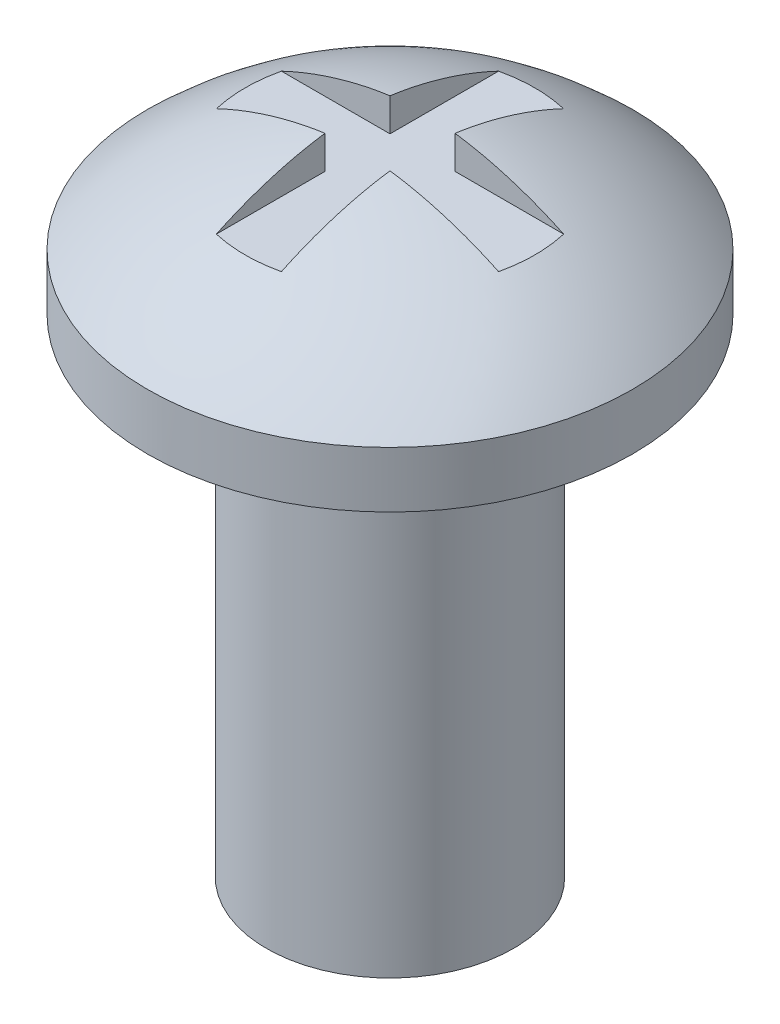
from build123d import *

# Parameters (mm, degrees)
CUT_EXTRUDE1_DEPTH = 0.635
CIRPATTERN1_COUNT  = 4


with BuildPart() as part:
    # Sketch1 → Revolve1 (revolve)
    with BuildSketch(Plane.XY, mode=Mode.PRIVATE) as revolve1_sk:
        with BuildLine():
            Line((0, 0), (2.413, 0))
            Line((2.413, 0), (2.413, 9.525))
            Line((2.413, 9.525), (4.7371, 9.525))
            Line((4.7371, 9.525), (4.7371, 10.618743367))
            ThreePointArc((4.7371, 10.618743367), (2.548065575, 12.067962924), (0, 12.7))
            Line((0, 12.7), (0, 0))
        make_face()
    revolve(revolve1_sk.sketch.rotate(Axis((0, 0, 0), (0, 1, 0)), 90), axis=Axis((0, 0, 0), (0, 1, 0)))

    # Sketch2 → Cut-Extrude1 (cut, symmetric)
    with BuildSketch(Plane.XY):
        with BuildLine():
            Line((0, 11.938), (2.828492677, 11.938))
            ThreePointArc((2.828492677, 11.938), (1.450712269, 12.454359079), (0, 12.7))
            Line((0, 12.7), (0, 11.938))
        make_face()
    cut_extrude1 = extrude(amount=CUT_EXTRUDE1_DEPTH, both=True, mode=Mode.SUBTRACT)

    # CirPattern1: Cut-Extrude1 ×4 about axis
    cirpattern1_axis = Axis((0, 0, 0), (0, 1, 0))
    for i in range(1, CIRPATTERN1_COUNT):
        add(cut_extrude1.rotate(cirpattern1_axis, i * 360 / CIRPATTERN1_COUNT), mode=Mode.SUBTRACT)


solid = part.part
